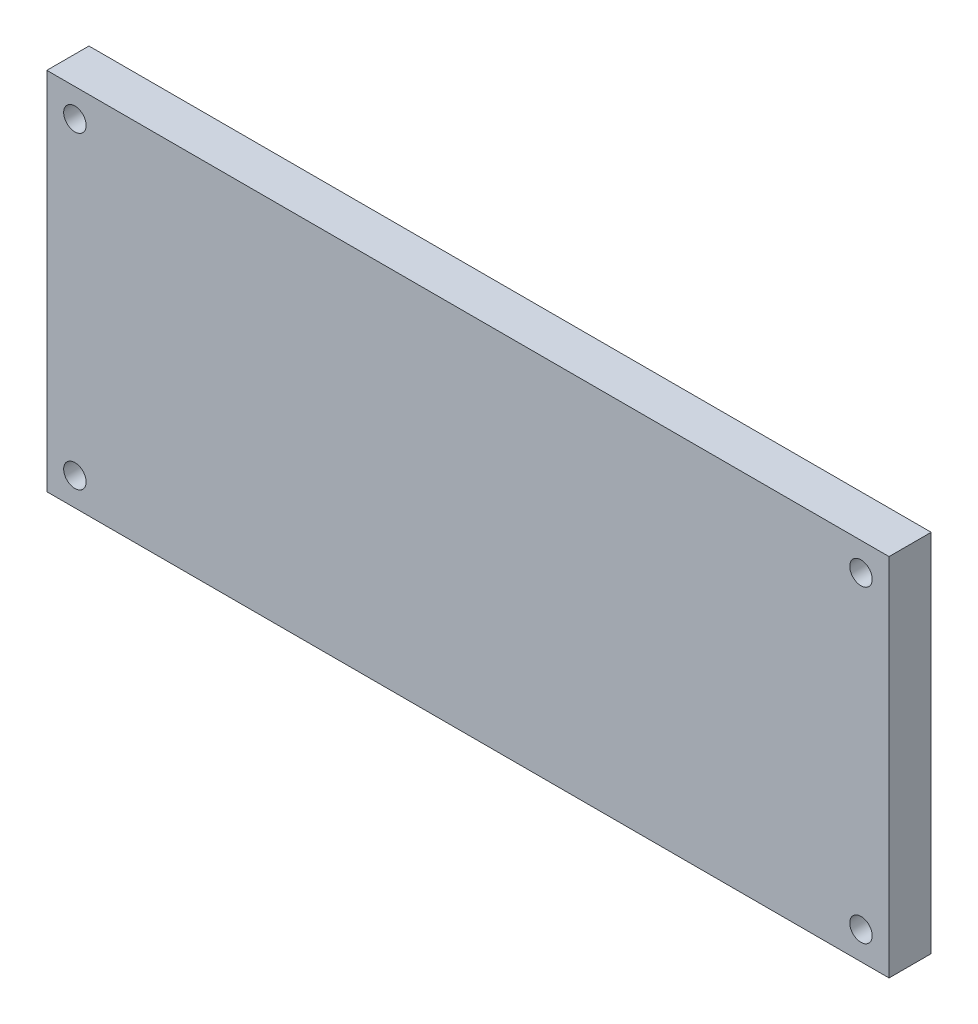
from build123d import *

# Parameters (mm, degrees)
ESQUISSE1_W             = 300
ESQUISSE1_H             = 130
BOSS_EXTRU_1_DEPTH      = 15
ESQUISSE2_R             = 4
ENL_V_MAT_EXTRU_2_DEPTH = 415.976615042
ESQUISSE3_R             = 4
ENL_V_MAT_EXTRU_3_DEPTH = 415.976615042
ESQUISSE5_R             = 4
ENL_V_MAT_EXTRU_4_DEPTH = 415.976615042


with BuildPart() as part:
    # Esquisse1 → Boss.-Extru.1 (new body)
    with BuildSketch(Plane.XY):
        with Locations((-243.802731113, 65)):
            Rectangle(ESQUISSE1_W, ESQUISSE1_H)
    extrude(amount=BOSS_EXTRU_1_DEPTH)

    # Esquisse2 → Enlèv. mat.-Extru.2 (cut, through all)
    with BuildSketch(Plane.XY.offset(15)):
        with Locations((-383.802731113, 120)):
            Circle(ESQUISSE2_R)
    extrude(amount=-ENL_V_MAT_EXTRU_2_DEPTH, mode=Mode.SUBTRACT)

    # Esquisse3 → Enlèv. mat.-Extru.3 (cut, through all)
    with BuildSketch(Plane.XY.offset(15)):
        with Locations((-103.802731113, 10)):
            Circle(ESQUISSE3_R)
    extrude(amount=-ENL_V_MAT_EXTRU_3_DEPTH, mode=Mode.SUBTRACT)

    # Esquisse5 → Enlèv. mat.-Extru.4 (cut, through all)
    with BuildSketch(Plane(origin=(0, 0, 0), x_dir=(-1, 0, 0), z_dir=(0, 0, -1))):
        with Locations((103.802731113, 120)):
            Circle(ESQUISSE5_R)
        with Locations((383.802731113, 10)):
            Circle(ESQUISSE5_R)
    extrude(amount=-ENL_V_MAT_EXTRU_4_DEPTH, mode=Mode.SUBTRACT)


solid = part.part
